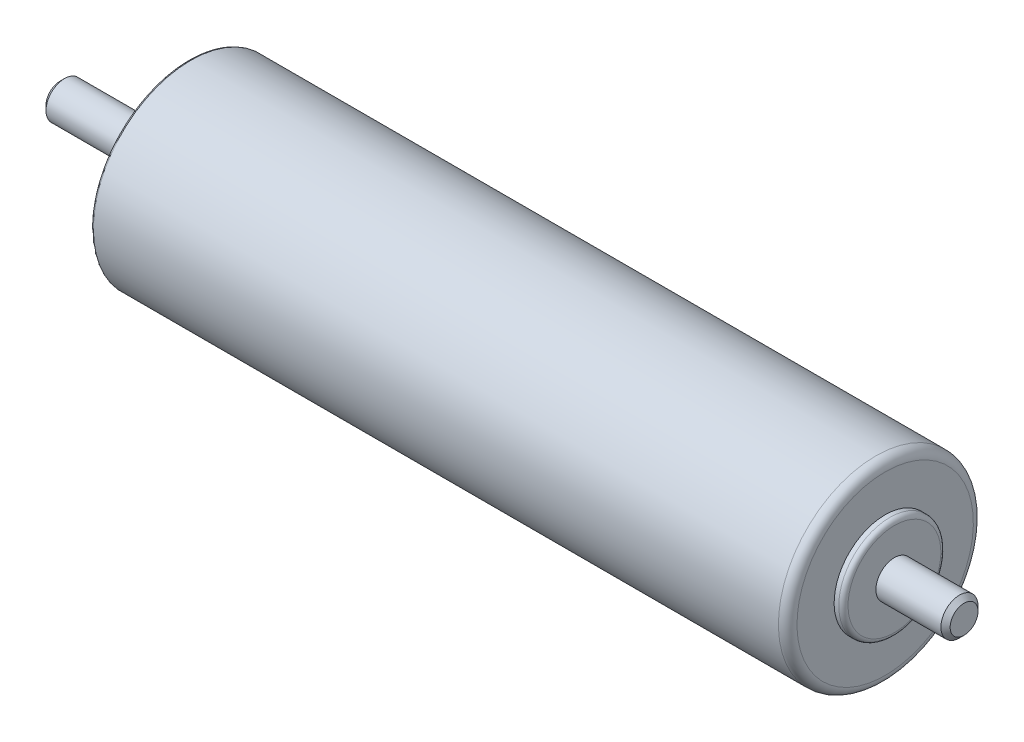
from build123d import *

# Parameters (mm, degrees)
CONG_3_R                     = 2
CONG_4_R                     = 1
CONG_5_R                     = 1
CHANFREIN2_SIZE              = 1
CHANFREIN3_SIZE              = 1
R_P_TITION_CIRCULAIRE1_COUNT = 4
CONG_6_R                     = 0.4
R_P_TITION_CIRCULAIRE2_COUNT = 4


with BuildPart() as part:
    # Esquisse1 → Révolution1 (revolve)
    with BuildSketch(Plane.XY):
        Polygon((0, 0), (0, 4), (25, 4), (25, 12.5), (27.8, 12.5), (27.8, 21), (177.8, 21), (177.8, 11), (179.8, 11), (179.8, 4), (194.8, 4), (194.8, 0), align=None)
    revolve(axis=Axis((194.8, 0, 0), (-1, 0, 0)))

    # Congé3
    cong_3_edges = [part.edges().sort_by_distance(p)[0] for p in [
        (177.8, -21, 0),
    ]]
    fillet(cong_3_edges, radius=CONG_3_R)

    # Congé4
    cong_4_edges = [part.edges().sort_by_distance(p)[0] for p in [
        (25, -12.5, 0),
    ]]
    fillet(cong_4_edges, radius=CONG_4_R)

    # Congé5
    cong_5_edges = [part.edges().sort_by_distance(p)[0] for p in [
        (179.8, -11, 0),
    ]]
    fillet(cong_5_edges, radius=CONG_5_R)

    # Chanfrein2
    chanfrein2_edges = [part.edges().sort_by_distance(p)[0] for p in [
        (0, -4, 0),
    ]]
    chamfer(chanfrein2_edges, length=CHANFREIN2_SIZE)

    # Chanfrein3
    chanfrein3_edges = [part.edges().sort_by_distance(p)[0] for p in [
        (194.8, -4, 0),
    ]]
    chamfer(chanfrein3_edges, length=CHANFREIN3_SIZE)

    # Esquisse6 → Trou taraudé M3x0.51 (revolve, cut)
    with BuildSketch(Plane(origin=(27.8, -0.248189437, 16), x_dir=(0, 0, 1), z_dir=(0, 1, 0))):
        Polygon((0, 0), (0, 9.251075774), (1.25, 8.5), (1.25, 0), align=None)
    trou_taraud_m3x0_51 = revolve(axis=Axis((21.45, -0.248189437, 16), (1, 0, 0)), mode=Mode.SUBTRACT)

    # Répétition circulaire1: Trou taraudé M3x0.51 ×4 about axis
    r_p_tition_circulaire1_axis = Axis((29.8, 0, 0), (1, 0, 0))
    for i in range(1, R_P_TITION_CIRCULAIRE1_COUNT):
        add(trou_taraud_m3x0_51.rotate(r_p_tition_circulaire1_axis, i * 360 / R_P_TITION_CIRCULAIRE1_COUNT), mode=Mode.SUBTRACT)

    # Congé6
    cong_6_edges = [part.edges().sort_by_distance(p)[0] for p in [
        (27.8, -21, 0),
    ]]
    fillet(cong_6_edges, radius=CONG_6_R)

    # Esquisse24 → Trou taraudé M4x0.72 (revolve, cut)
    with BuildSketch(Plane(origin=(27.8, -12.923800799, 12.52898132), x_dir=(0, 0, 1), z_dir=(0, 1, 0))):
        Polygon((0, 0), (0, 13.491420021), (1.65, 12.5), (1.65, 0), align=None)
    trou_taraud_m4x0_72 = revolve(axis=Axis((21.45, -12.923800799, 12.52898132), (1, 0, 0)), mode=Mode.SUBTRACT)

    # Répétition circulaire2: Trou taraudé M4x0.72 ×4 about axis
    r_p_tition_circulaire2_axis = Axis((29.8, 0, 0), (1, 0, 0))
    for i in range(1, R_P_TITION_CIRCULAIRE2_COUNT):
        add(trou_taraud_m4x0_72.rotate(r_p_tition_circulaire2_axis, i * 360 / R_P_TITION_CIRCULAIRE2_COUNT), mode=Mode.SUBTRACT)


solid = part.part
